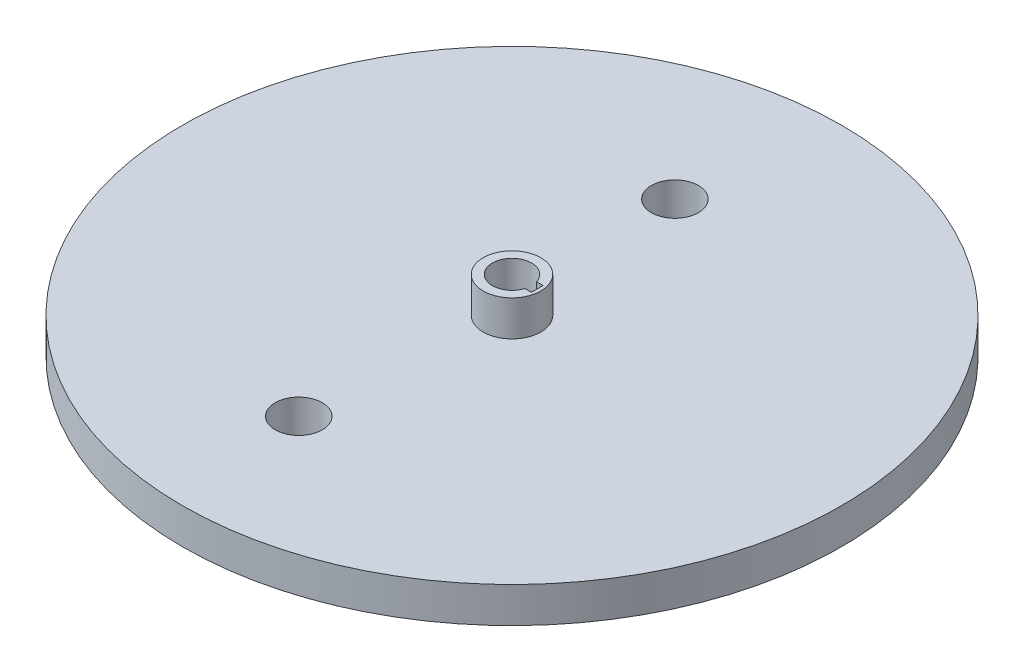
from build123d import *

# Parameters (mm, degrees)
SKETCH1_R           = 140
BOSS_EXTRUDE1_DEPTH = 30.25
SKETCH2_R           = 36.5
SKETCH2_R_2         = 12.2445076
CUT_EXTRUDE1_DEPTH  = 15.125
SKETCH3_R           = 150
SKETCH3_R_2         = 12.938699975
CUT_EXTRUDE3_DEPTH  = 60
SKETCH4_R           = 10
CUT_EXTRUDE4_DEPTH  = 20


with BuildPart() as part:
    # Sketch1 → Boss-Extrude1 (new body)
    with BuildSketch(Plane(origin=(0, 0, 0), x_dir=(1, 0, 0), z_dir=(0, 1, 0))):
        with Locations(Location((0, 0, 0), (0, 0, 270))):
            Circle(SKETCH1_R)
        with BuildLine():
            Line((10.74, 0), (10.74, 2.5))
            Line((10.74, 2.5), (7.956481634, 2.5))
            ThreePointArc((7.956481634, 2.5), (-8.34, 0), (7.956481634, -2.5))
            Line((7.956481634, -2.5), (10.74, -2.5))
            Line((10.74, -2.5), (10.74, 0))
        make_face(mode=Mode.SUBTRACT)
    extrude(amount=BOSS_EXTRUDE1_DEPTH)

    # Sketch2 → Cut-Extrude1 (cut)
    with BuildSketch(Plane(origin=(0, 30.25, 0), x_dir=(1, 0, 0), z_dir=(0, 1, 0))):
        with Locations(Location((0, 0, 0), (0, 0, 270))):
            Circle(SKETCH2_R)
        with Locations(Location((0, 0, 0), (0, 0, 270))):
            Circle(SKETCH2_R_2, mode=Mode.SUBTRACT)
    extrude(amount=-CUT_EXTRUDE1_DEPTH, mode=Mode.SUBTRACT)

    # Sketch3 → Cut-Extrude3 (cut)
    with BuildSketch(Plane(origin=(0, 15.125, 0), x_dir=(1, 0, 0), z_dir=(0, 1, 0))):
        Circle(SKETCH3_R)
        Circle(SKETCH3_R_2, mode=Mode.SUBTRACT)
    extrude(amount=CUT_EXTRUDE3_DEPTH, mode=Mode.SUBTRACT)

    # Sketch4 → Cut-Extrude4 (cut)
    with BuildSketch(Plane(origin=(0, 0, 0), x_dir=(-1, 0, 0), z_dir=(0, -1, 0))):
        with Locations(Location((8.202870942, 77.402383207, 0), (0, 0, 90))):
            Circle(SKETCH4_R)
        with Locations(Location((8.202870942, -82.387978989, 0), (0, 0, 90))):
            Circle(SKETCH4_R)
    extrude(amount=-CUT_EXTRUDE4_DEPTH, mode=Mode.SUBTRACT)


solid = part.part
